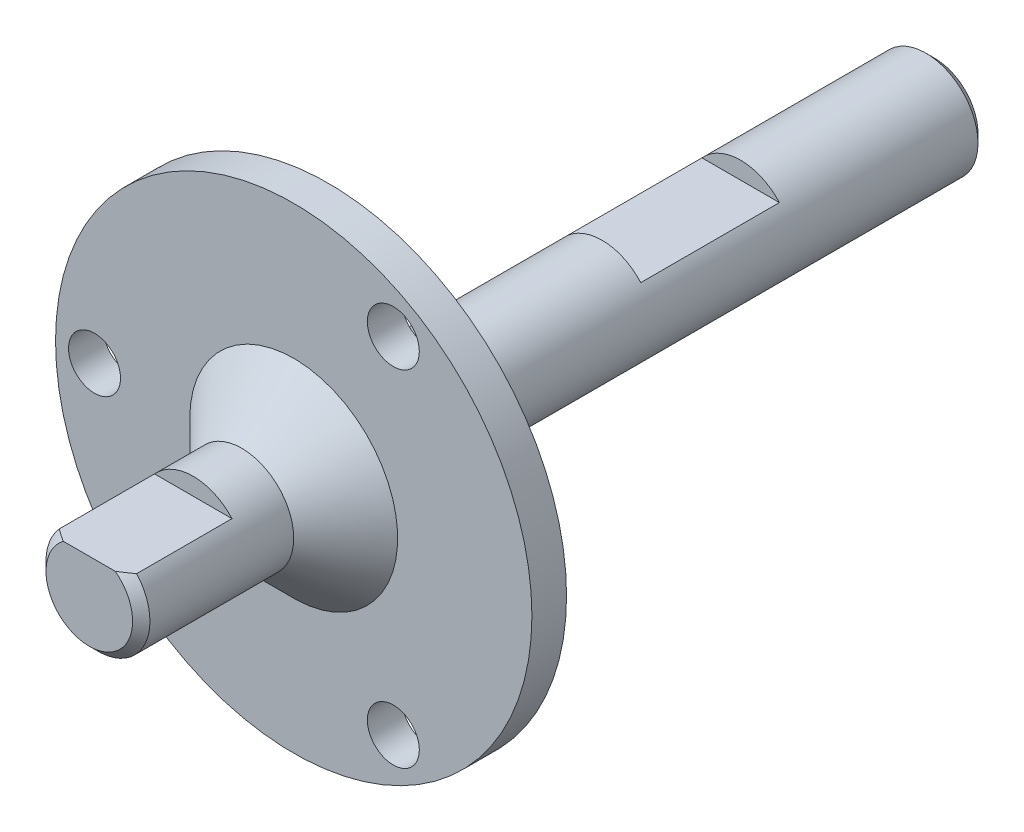
from build123d import *

# Parameters (mm, degrees)
CUT_EXTRUDE_START   = 3
SKETCH_2_W          = 6
SKETCH_2_H          = 8
SKETCH_2_H_2        = 6
CUT_EXTRUDE_1_DEPTH = 1
CHAMFER_1_SIZE      = 3
SKETCH_3_R          = 1.5
CUT_EXTRUDE_4_DEPTH = 42.798624379
CHAMFER_2_SIZE      = 0.5


with BuildPart() as part:
    # 草图1 → 旋转1 (revolve)
    with BuildSketch(Plane(origin=(0, 0, 0), x_dir=(0, 0, -1), z_dir=(1, 0, 0)), mode=Mode.PRIVATE) as revolve_1_sk:
        Polygon((0, 0), (0, 3), (11.8, 3), (11.8, 13.75), (13.8, 13.75), (13.8, 3), (48.8, 3), (48.8, 0), align=None)
    revolve(revolve_1_sk.sketch.rotate(Axis((0, 0, 33.540983607), (0, 0, -1)), 90), axis=Axis((0, 0, 33.540983607), (0, 0, -1)))

    # 草图2 → 切除-拉伸1 (cut)
    with BuildSketch(Plane(origin=(0, 0, 0), x_dir=(1, 0, 0), z_dir=(0, 1, 0)).offset(CUT_EXTRUDE_START)):
        with Locations((0, 33.6)):
            Rectangle(SKETCH_2_W, SKETCH_2_H)
        with Locations((0, 3)):
            Rectangle(SKETCH_2_W, SKETCH_2_H_2)
    extrude(amount=-CUT_EXTRUDE_1_DEPTH, mode=Mode.SUBTRACT)

    # 倒角1
    chamfer_1_edges = [part.edges().sort_by_distance(p)[0] for p in [
        (-3, 0, -11.8),
    ]]
    chamfer(chamfer_1_edges, length=CHAMFER_1_SIZE)

    # 草图3 → 切除-拉伸4 (cut, through all)
    with BuildSketch(Plane.XY.offset(-11.8)):
        with Locations((5.75, -9.959292144)):
            Circle(SKETCH_3_R)
        with Locations((-11.5, 0)):
            Circle(SKETCH_3_R)
        with Locations((5.75, 9.959292144)):
            Circle(SKETCH_3_R)
    extrude(amount=-CUT_EXTRUDE_4_DEPTH, mode=Mode.SUBTRACT)

    # 倒角2
    chamfer_2_edges = [part.edges().sort_by_distance(p)[0] for p in [
        (-1.070466269, -2.802517077, 0),
        (-3, 0, -48.8),
    ]]
    chamfer(chamfer_2_edges, length=CHAMFER_2_SIZE)


solid = part.part
